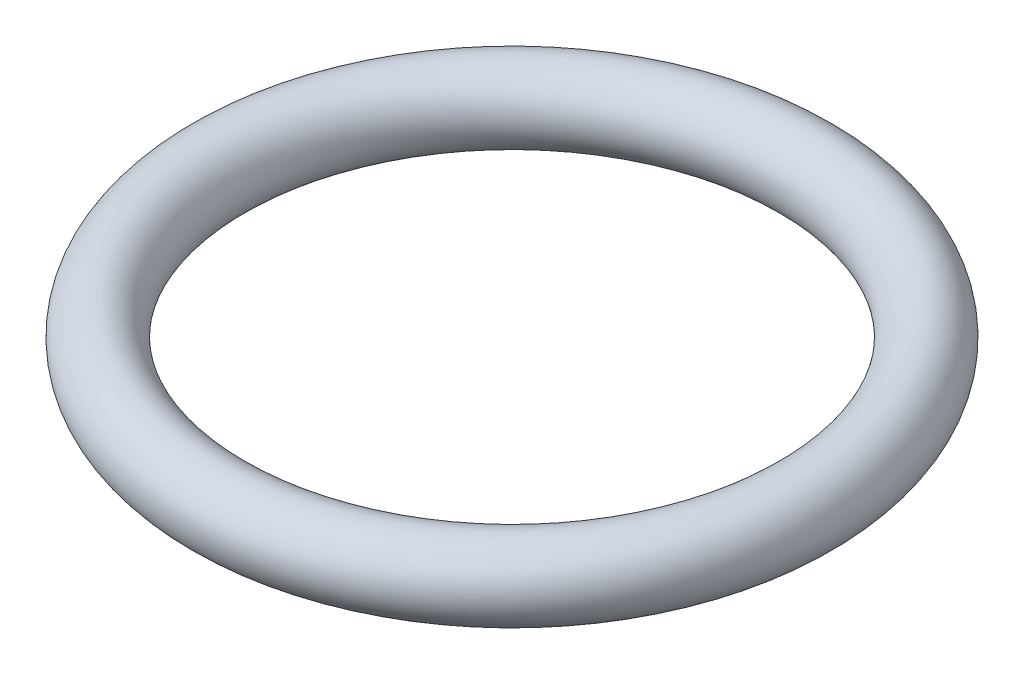
from build123d import *

# Parameters (mm, degrees)
SKETCH_1_R = 3.25


with BuildPart() as part:
    # 草图1 → 旋转1 (revolve)
    with BuildSketch(Plane.XY, mode=Mode.PRIVATE) as revolve_1_sk:
        with Locations((-26, 0)):
            Circle(SKETCH_1_R)
    revolve(revolve_1_sk.sketch.rotate(Axis((0, 16.879134857, 0), (0, -1, 0)), 270), axis=Axis((0, 16.879134857, 0), (0, -1, 0)))


solid = part.part
